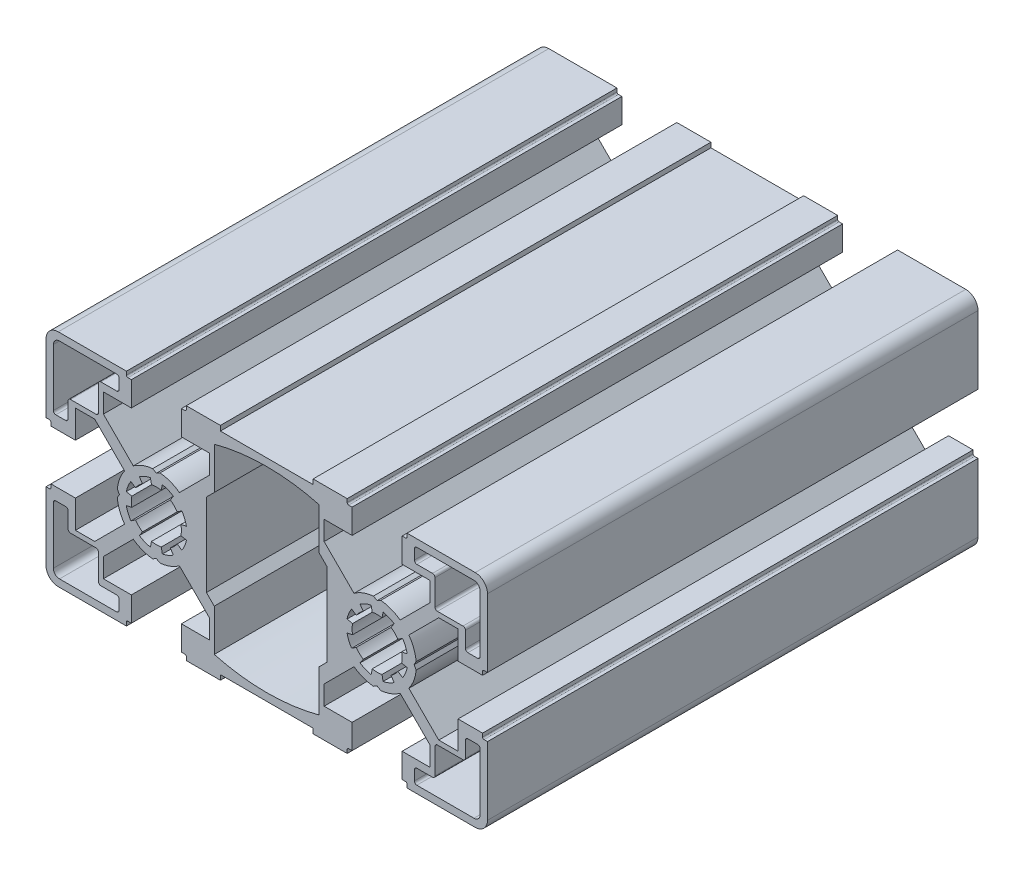
from build123d import *

# Parameters (mm, degrees)
EXTRUDE_1_DEPTH = 100


with BuildPart() as part:
    # 草图1 → 凸台-拉伸1 (new body)
    with BuildSketch(Plane.XY):
        with BuildLine():
            Line((-29.082808051, 22.045792426), (-42.982808051, 22.045792426))
            ThreePointArc((-42.982808051, 22.045792426), (-44.750575003, 21.313559379), (-45.482808051, 19.545792426))
            Line((-45.482808051, 19.545792426), (-45.482808051, 5.645792426))
            Line((-45.482808051, 5.645792426), (-44.782808051, 5.645792426))
            ThreePointArc((-44.782808051, 5.645792426), (-44.570676016, 5.557924461), (-44.482808051, 5.345792426))
            Line((-44.482808051, 5.345792426), (-44.482808051, 4.645792426))
            Line((-44.482808051, 4.645792426), (-42.582808051, 4.645792426))
            Line((-42.582808051, 4.645792426), (-41.382808051, 4.645792426))
            Line((-41.382808051, 4.645792426), (-39.482808051, 4.645792426))
            Line((-39.482808051, 4.645792426), (-39.482808051, 10.345792426))
            Line((-39.482808051, 10.345792426), (-35.550575003, 10.345792426))
            Line((-35.550575003, 10.345792426), (-29.454065687, 4.24928311))
            ThreePointArc((-29.454065687, 4.24928311), (-30.466605076, 2.372943304), (-30.947574212, 0.295792426))
            Line((-30.947574212, 0.295792426), (-30.51456151, -0.454207574))
            Line((-30.51456151, -0.454207574), (-30.947574212, -1.204207574))
            ThreePointArc((-30.947574212, -1.204207574), (-30.466605076, -3.281358452), (-29.454065687, -5.157698257))
            Line((-29.454065687, -5.157698257), (-35.550575003, -11.254207574))
            Line((-35.550575003, -11.254207574), (-39.482808051, -11.254207574))
            Line((-39.482808051, -11.254207574), (-39.482808051, -5.554207574))
            Line((-39.482808051, -5.554207574), (-41.382808051, -5.554207574))
            Line((-41.382808051, -5.554207574), (-42.582808051, -5.554207574))
            Line((-42.582808051, -5.554207574), (-44.482808051, -5.554207574))
            Line((-44.482808051, -5.554207574), (-44.482808051, -6.254207574))
            ThreePointArc((-44.482808051, -6.254207574), (-44.570676016, -6.466339608), (-44.782808051, -6.554207574))
            Line((-44.782808051, -6.554207574), (-45.482808051, -6.554207574))
            Line((-45.482808051, -6.554207574), (-45.482808051, -20.454207574))
            ThreePointArc((-45.482808051, -20.454207574), (-44.750575003, -22.221974527), (-42.982808051, -22.954207574))
            Line((-42.982808051, -22.954207574), (-29.082808051, -22.954207574))
            Line((-29.082808051, -22.954207574), (-29.082808051, -22.254207574))
            ThreePointArc((-29.082808051, -22.254207574), (-28.994940085, -22.042075539), (-28.782808051, -21.954207574))
            Line((-28.782808051, -21.954207574), (-28.082808051, -21.954207574))
            Line((-28.082808051, -21.954207574), (-28.082808051, -20.054207574))
            Line((-28.082808051, -20.054207574), (-28.082808051, -18.854207574))
            Line((-28.082808051, -18.854207574), (-28.082808051, -16.954207574))
            Line((-28.082808051, -16.954207574), (-33.782808051, -16.954207574))
            Line((-33.782808051, -16.954207574), (-33.782808051, -13.021974527))
            Line((-33.782808051, -13.021974527), (-27.686298734, -6.92546521))
            ThreePointArc((-27.686298734, -6.92546521), (-25.809958928, -7.938004599), (-23.732808051, -8.418973735))
            Line((-23.732808051, -8.418973735), (-22.982808051, -7.985961033))
            Line((-22.982808051, -7.985961033), (-22.232808051, -8.418973735))
            ThreePointArc((-22.232808051, -8.418973735), (-20.155657173, -7.938004599), (-18.279317367, -6.92546521))
            Line((-18.279317367, -6.92546521), (-12.182808051, -13.021974527))
            Line((-12.182808051, -13.021974527), (-12.182808051, -16.954207574))
            Line((-12.182808051, -16.954207574), (-17.882808051, -16.954207574))
            Line((-17.882808051, -16.954207574), (-17.882808051, -18.854207574))
            Line((-17.882808051, -18.854207574), (-17.882808051, -20.054207574))
            Line((-17.882808051, -20.054207574), (-17.882808051, -21.954207574))
            Line((-17.882808051, -21.954207574), (-17.182808051, -21.954207574))
            ThreePointArc((-17.182808051, -21.954207574), (-16.970676016, -22.042075539), (-16.882808051, -22.254207574))
            Line((-16.882808051, -22.254207574), (-16.882808051, -22.954207574))
            Line((-16.882808051, -22.954207574), (-9.932808051, -22.954207574))
            Line((-9.932808051, -22.954207574), (-9.932808051, -21.954207574))
            Line((-9.932808051, -21.954207574), (8.967191949, -21.954207574))
            Line((8.967191949, -21.954207574), (8.967191949, -22.954207574))
            Line((8.967191949, -22.954207574), (15.917191949, -22.954207574))
            Line((15.917191949, -22.954207574), (15.917191949, -22.254207574))
            ThreePointArc((15.917191949, -22.254207574), (16.005059915, -22.042075539), (16.217191949, -21.954207574))
            Line((16.217191949, -21.954207574), (16.917191949, -21.954207574))
            Line((16.917191949, -21.954207574), (16.917191949, -20.054207574))
            Line((16.917191949, -20.054207574), (16.917191949, -18.854207574))
            Line((16.917191949, -18.854207574), (16.917191949, -16.954207574))
            Line((16.917191949, -16.954207574), (11.217191949, -16.954207574))
            Line((11.217191949, -16.954207574), (11.217191949, -13.021974527))
            Line((11.217191949, -13.021974527), (17.313701266, -6.92546521))
            ThreePointArc((17.313701266, -6.92546521), (19.190041072, -7.938004599), (21.267191949, -8.418973735))
            Line((21.267191949, -8.418973735), (22.017191949, -7.985961033))
            Line((22.017191949, -7.985961033), (22.767191949, -8.418973735))
            ThreePointArc((22.767191949, -8.418973735), (24.844342827, -7.938004599), (26.720682633, -6.92546521))
            Line((26.720682633, -6.92546521), (32.817191949, -13.021974527))
            Line((32.817191949, -13.021974527), (32.817191949, -16.954207574))
            Line((32.817191949, -16.954207574), (27.117191949, -16.954207574))
            Line((27.117191949, -16.954207574), (27.117191949, -18.854207574))
            Line((27.117191949, -18.854207574), (27.117191949, -20.054207574))
            Line((27.117191949, -20.054207574), (27.117191949, -21.954207574))
            Line((27.117191949, -21.954207574), (27.817191949, -21.954207574))
            ThreePointArc((27.817191949, -21.954207574), (28.029323984, -22.042075539), (28.117191949, -22.254207574))
            Line((28.117191949, -22.254207574), (28.117191949, -22.954207574))
            Line((28.117191949, -22.954207574), (42.017191949, -22.954207574))
            ThreePointArc((42.017191949, -22.954207574), (43.784958902, -22.221974527), (44.517191949, -20.454207574))
            Line((44.517191949, -20.454207574), (44.517191949, -6.554207574))
            Line((44.517191949, -6.554207574), (43.817191949, -6.554207574))
            ThreePointArc((43.817191949, -6.554207574), (43.605059915, -6.466339608), (43.517191949, -6.254207574))
            Line((43.517191949, -6.254207574), (43.517191949, -5.554207574))
            Line((43.517191949, -5.554207574), (41.617191949, -5.554207574))
            Line((41.617191949, -5.554207574), (40.417191949, -5.554207574))
            Line((40.417191949, -5.554207574), (38.517191949, -5.554207574))
            Line((38.517191949, -5.554207574), (38.517191949, -11.254207574))
            Line((38.517191949, -11.254207574), (34.584958902, -11.254207574))
            Line((34.584958902, -11.254207574), (28.488449586, -5.157698257))
            ThreePointArc((28.488449586, -5.157698257), (29.500988975, -3.281358452), (29.981958111, -1.204207574))
            Line((29.981958111, -1.204207574), (29.548945409, -0.454207574))
            Line((29.548945409, -0.454207574), (29.981958111, 0.295792426))
            ThreePointArc((29.981958111, 0.295792426), (29.500988975, 2.372943304), (28.488449586, 4.24928311))
            Line((28.488449586, 4.24928311), (34.584958902, 10.345792426))
            Line((34.584958902, 10.345792426), (38.517191949, 10.345792426))
            Line((38.517191949, 10.345792426), (38.517191949, 4.645792426))
            Line((38.517191949, 4.645792426), (40.417191949, 4.645792426))
            Line((40.417191949, 4.645792426), (41.617191949, 4.645792426))
            Line((41.617191949, 4.645792426), (43.517191949, 4.645792426))
            Line((43.517191949, 4.645792426), (43.517191949, 5.345792426))
            ThreePointArc((43.517191949, 5.345792426), (43.605059915, 5.557924461), (43.817191949, 5.645792426))
            Line((43.817191949, 5.645792426), (44.517191949, 5.645792426))
            Line((44.517191949, 5.645792426), (44.517191949, 19.545792426))
            ThreePointArc((44.517191949, 19.545792426), (43.784958902, 21.313559379), (42.017191949, 22.045792426))
            Line((42.017191949, 22.045792426), (28.117191949, 22.045792426))
            Line((28.117191949, 22.045792426), (28.117191949, 21.345792426))
            ThreePointArc((28.117191949, 21.345792426), (28.029323984, 21.133660392), (27.817191949, 21.045792426))
            Line((27.817191949, 21.045792426), (27.117191949, 21.045792426))
            Line((27.117191949, 21.045792426), (27.117191949, 19.145792426))
            Line((27.117191949, 19.145792426), (27.117191949, 17.945792426))
            Line((27.117191949, 17.945792426), (27.117191949, 16.045792426))
            Line((27.117191949, 16.045792426), (32.817191949, 16.045792426))
            Line((32.817191949, 16.045792426), (32.817191949, 12.113559379))
            Line((32.817191949, 12.113559379), (26.720682633, 6.017050063))
            ThreePointArc((26.720682633, 6.017050063), (24.844342827, 7.029589452), (22.767191949, 7.510558587))
            Line((22.767191949, 7.510558587), (22.017191949, 7.077545886))
            Line((22.017191949, 7.077545886), (21.267191949, 7.510558587))
            ThreePointArc((21.267191949, 7.510558587), (19.190041072, 7.029589452), (17.313701266, 6.017050063))
            Line((17.313701266, 6.017050063), (11.217191949, 12.113559379))
            Line((11.217191949, 12.113559379), (11.217191949, 16.045792426))
            Line((11.217191949, 16.045792426), (16.917191949, 16.045792426))
            Line((16.917191949, 16.045792426), (16.917191949, 17.945792426))
            Line((16.917191949, 17.945792426), (16.917191949, 19.145792426))
            Line((16.917191949, 19.145792426), (16.917191949, 21.045792426))
            Line((16.917191949, 21.045792426), (16.217191949, 21.045792426))
            ThreePointArc((16.217191949, 21.045792426), (16.005059915, 21.133660392), (15.917191949, 21.345792426))
            Line((15.917191949, 21.345792426), (15.917191949, 22.045792426))
            Line((15.917191949, 22.045792426), (8.967191949, 22.045792426))
            Line((8.967191949, 22.045792426), (8.967191949, 21.045792426))
            Line((8.967191949, 21.045792426), (-9.932808051, 21.045792426))
            Line((-9.932808051, 21.045792426), (-9.932808051, 22.045792426))
            Line((-9.932808051, 22.045792426), (-16.882808051, 22.045792426))
            Line((-16.882808051, 22.045792426), (-16.882808051, 21.345792426))
            ThreePointArc((-16.882808051, 21.345792426), (-16.970676016, 21.133660392), (-17.182808051, 21.045792426))
            Line((-17.182808051, 21.045792426), (-17.882808051, 21.045792426))
            Line((-17.882808051, 21.045792426), (-17.882808051, 19.145792426))
            Line((-17.882808051, 19.145792426), (-17.882808051, 17.620792426))
            Line((-17.882808051, 17.620792426), (-17.882808051, 16.045792426))
            Line((-17.882808051, 16.045792426), (-12.182808051, 16.045792426))
            Line((-12.182808051, 16.045792426), (-12.182808051, 12.113559379))
            Line((-12.182808051, 12.113559379), (-18.279317367, 6.017050063))
            ThreePointArc((-18.279317367, 6.017050063), (-20.155657173, 7.029589452), (-22.232808051, 7.510558587))
            Line((-22.232808051, 7.510558587), (-22.982808051, 7.077545886))
            Line((-22.982808051, 7.077545886), (-23.732808051, 7.510558587))
            ThreePointArc((-23.732808051, 7.510558587), (-25.809958928, 7.029589452), (-27.686298734, 6.017050063))
            Line((-27.686298734, 6.017050063), (-33.782808051, 12.113559379))
            Line((-33.782808051, 12.113559379), (-33.782808051, 16.045792426))
            Line((-33.782808051, 16.045792426), (-28.082808051, 16.045792426))
            Line((-28.082808051, 16.045792426), (-28.082808051, 17.945792426))
            Line((-28.082808051, 17.945792426), (-28.082808051, 19.145792426))
            Line((-28.082808051, 19.145792426), (-28.082808051, 21.045792426))
            Line((-28.082808051, 21.045792426), (-28.782808051, 21.045792426))
            ThreePointArc((-28.782808051, 21.045792426), (-28.994940085, 21.133660392), (-29.082808051, 21.345792426))
            Line((-29.082808051, 21.345792426), (-29.082808051, 22.045792426))
        make_face()
        with BuildLine():
            Line((-43.482808051, 7.145792426), (-41.482808051, 7.145792426))
            ThreePointArc((-41.482808051, 7.145792426), (-41.12925466, 7.292239036), (-40.982808051, 7.645792426))
            Line((-40.982808051, 7.645792426), (-40.982808051, 10.845792426))
            ThreePointArc((-40.982808051, 10.845792426), (-40.836361441, 11.199345817), (-40.482808051, 11.345792426))
            Line((-40.482808051, 11.345792426), (-35.282808051, 11.345792426))
            ThreePointArc((-35.282808051, 11.345792426), (-34.92925466, 11.492239036), (-34.782808051, 11.845792426))
            Line((-34.782808051, 11.845792426), (-34.782808051, 17.045792426))
            ThreePointArc((-34.782808051, 17.045792426), (-34.636361441, 17.399345817), (-34.282808051, 17.545792426))
            Line((-34.282808051, 17.545792426), (-31.082808051, 17.545792426))
            ThreePointArc((-31.082808051, 17.545792426), (-30.72925466, 17.692239036), (-30.582808051, 18.045792426))
            Line((-30.582808051, 18.045792426), (-30.582808051, 20.045792426))
            ThreePointArc((-30.582808051, 20.045792426), (-30.72925466, 20.399345817), (-31.082808051, 20.545792426))
            Line((-31.082808051, 20.545792426), (-42.732808051, 20.545792426))
            ThreePointArc((-42.732808051, 20.545792426), (-43.616691527, 20.179675903), (-43.982808051, 19.295792426))
            Line((-43.982808051, 19.295792426), (-43.982808051, 7.645792426))
            ThreePointArc((-43.982808051, 7.645792426), (-43.836361441, 7.292239036), (-43.482808051, 7.145792426))
        make_face(mode=Mode.SUBTRACT)
        with BuildLine():
            Line((-11.182808051, 9.578025473), (-12.782808051, 7.978025473))
            Line((-12.782808051, 7.978025473), (-12.782808051, -8.886440621))
            Line((-12.782808051, -8.886440621), (-11.182808051, -10.486440621))
            Line((-11.182808051, -10.486440621), (-11.182808051, -19.014996693))
            ThreePointArc((-11.182808051, -19.014996693), (-0.482808051, -20.419335391), (10.217191949, -19.014996693))
            Line((10.217191949, -19.014996693), (10.217191949, -10.486440621))
            Line((10.217191949, -10.486440621), (11.817191949, -8.886440621))
            Line((11.817191949, -8.886440621), (11.817191949, 7.978025473))
            Line((11.817191949, 7.978025473), (10.217191949, 9.578025473))
            Line((10.217191949, 9.578025473), (10.217191949, 18.106581546))
            ThreePointArc((10.217191949, 18.106581546), (-0.482808051, 19.510920243), (-11.182808051, 18.106581546))
            Line((-11.182808051, 18.106581546), (-11.182808051, 9.578025473))
        make_face(mode=Mode.SUBTRACT)
        with BuildLine():
            Line((-43.482808051, -8.054207574), (-41.482808051, -8.054207574))
            ThreePointArc((-41.482808051, -8.054207574), (-41.12925466, -8.200654183), (-40.982808051, -8.554207574))
            Line((-40.982808051, -8.554207574), (-40.982808051, -11.754207574))
            ThreePointArc((-40.982808051, -11.754207574), (-40.836361441, -12.107760964), (-40.482808051, -12.254207574))
            Line((-40.482808051, -12.254207574), (-35.282808051, -12.254207574))
            ThreePointArc((-35.282808051, -12.254207574), (-34.92925466, -12.400654183), (-34.782808051, -12.754207574))
            Line((-34.782808051, -12.754207574), (-34.782808051, -17.954207574))
            ThreePointArc((-34.782808051, -17.954207574), (-34.636361441, -18.307760964), (-34.282808051, -18.454207574))
            Line((-34.282808051, -18.454207574), (-31.082808051, -18.454207574))
            ThreePointArc((-31.082808051, -18.454207574), (-30.72925466, -18.600654183), (-30.582808051, -18.954207574))
            Line((-30.582808051, -18.954207574), (-30.582808051, -20.954207574))
            ThreePointArc((-30.582808051, -20.954207574), (-30.72925466, -21.307760964), (-31.082808051, -21.454207574))
            Line((-31.082808051, -21.454207574), (-42.732808051, -21.454207574))
            ThreePointArc((-42.732808051, -21.454207574), (-43.616691527, -21.08809105), (-43.982808051, -20.204207574))
            Line((-43.982808051, -20.204207574), (-43.982808051, -8.554207574))
            ThreePointArc((-43.982808051, -8.554207574), (-43.836361441, -8.200654183), (-43.482808051, -8.054207574))
        make_face(mode=Mode.SUBTRACT)
        with BuildLine():
            Line((-26.455122007, -5.650892651), (-25.816216239, -4.694702596))
            ThreePointArc((-25.816216239, -4.694702596), (-26.589052635, -4.060452158), (-27.223303073, -3.287615762))
            Line((-27.223303073, -3.287615762), (-28.179493127, -3.92652153))
            ThreePointArc((-28.179493127, -3.92652153), (-28.757055129, -2.845979026), (-29.112716053, -1.673522086))
            Line((-29.112716053, -1.673522086), (-27.984812981, -1.449168216))
            ThreePointArc((-27.984812981, -1.449168216), (-28.082808051, -0.454207574), (-27.984812981, 0.540753069))
            Line((-27.984812981, 0.540753069), (-29.112716053, 0.765106939))
            ThreePointArc((-29.112716053, 0.765106939), (-28.757055129, 1.937563879), (-28.179493127, 3.018106383))
            Line((-28.179493127, 3.018106383), (-27.223303073, 2.379200615))
            ThreePointArc((-27.223303073, 2.379200615), (-26.589052635, 3.15203701), (-25.816216239, 3.786287449))
            Line((-25.816216239, 3.786287449), (-26.455122007, 4.742477503))
            ThreePointArc((-26.455122007, 4.742477503), (-25.374579503, 5.320039505), (-24.202122563, 5.675700429))
            Line((-24.202122563, 5.675700429), (-23.977768693, 4.547797356))
            ThreePointArc((-23.977768693, 4.547797356), (-22.982808051, 4.645792426), (-21.987847408, 4.547797356))
            Line((-21.987847408, 4.547797356), (-21.763493538, 5.675700429))
            ThreePointArc((-21.763493538, 5.675700429), (-20.591036598, 5.320039505), (-19.510494094, 4.742477503))
            Line((-19.510494094, 4.742477503), (-20.149399862, 3.786287449))
            ThreePointArc((-20.149399862, 3.786287449), (-19.376563466, 3.15203701), (-18.742313028, 2.379200615))
            Line((-18.742313028, 2.379200615), (-17.786122974, 3.018106383))
            ThreePointArc((-17.786122974, 3.018106383), (-17.208560972, 1.937563879), (-16.852900048, 0.765106939))
            Line((-16.852900048, 0.765106939), (-17.98080312, 0.540753069))
            ThreePointArc((-17.98080312, 0.540753069), (-17.882808051, -0.454207574), (-17.98080312, -1.449168216))
            Line((-17.98080312, -1.449168216), (-16.852900048, -1.673522086))
            ThreePointArc((-16.852900048, -1.673522086), (-17.208560972, -2.845979026), (-17.786122974, -3.92652153))
            Line((-17.786122974, -3.92652153), (-18.742313028, -3.287615762))
            ThreePointArc((-18.742313028, -3.287615762), (-19.376563466, -4.060452158), (-20.149399862, -4.694702596))
            Line((-20.149399862, -4.694702596), (-19.510494094, -5.650892651))
            ThreePointArc((-19.510494094, -5.650892651), (-20.591036598, -6.228454652), (-21.763493538, -6.584115576))
            Line((-21.763493538, -6.584115576), (-21.987847408, -5.456212504))
            ThreePointArc((-21.987847408, -5.456212504), (-22.982808051, -5.554207574), (-23.977768693, -5.456212504))
            Line((-23.977768693, -5.456212504), (-24.202122563, -6.584115576))
            ThreePointArc((-24.202122563, -6.584115576), (-25.374579503, -6.228454652), (-26.455122007, -5.650892651))
        make_face(mode=Mode.SUBTRACT)
        with BuildLine():
            Line((42.517191949, 7.145792426), (40.517191949, 7.145792426))
            ThreePointArc((40.517191949, 7.145792426), (40.163638559, 7.292239036), (40.017191949, 7.645792426))
            Line((40.017191949, 7.645792426), (40.017191949, 10.845792426))
            ThreePointArc((40.017191949, 10.845792426), (39.87074534, 11.199345817), (39.517191949, 11.345792426))
            Line((39.517191949, 11.345792426), (34.317191949, 11.345792426))
            ThreePointArc((34.317191949, 11.345792426), (33.963638559, 11.492239036), (33.817191949, 11.845792426))
            Line((33.817191949, 11.845792426), (33.817191949, 17.045792426))
            ThreePointArc((33.817191949, 17.045792426), (33.67074534, 17.399345817), (33.317191949, 17.545792426))
            Line((33.317191949, 17.545792426), (30.117191949, 17.545792426))
            ThreePointArc((30.117191949, 17.545792426), (29.763638559, 17.692239036), (29.617191949, 18.045792426))
            Line((29.617191949, 18.045792426), (29.617191949, 20.045792426))
            ThreePointArc((29.617191949, 20.045792426), (29.763638559, 20.399345817), (30.117191949, 20.545792426))
            Line((30.117191949, 20.545792426), (41.767191949, 20.545792426))
            ThreePointArc((41.767191949, 20.545792426), (42.651075426, 20.179675903), (43.017191949, 19.295792426))
            Line((43.017191949, 19.295792426), (43.017191949, 7.645792426))
            ThreePointArc((43.017191949, 7.645792426), (42.87074534, 7.292239036), (42.517191949, 7.145792426))
        make_face(mode=Mode.SUBTRACT)
        with BuildLine():
            Line((40.017191949, -8.554207574), (40.017191949, -11.754207574))
            ThreePointArc((40.017191949, -11.754207574), (39.87074534, -12.107760964), (39.517191949, -12.254207574))
            Line((39.517191949, -12.254207574), (34.317191949, -12.254207574))
            ThreePointArc((34.317191949, -12.254207574), (33.963638559, -12.400654183), (33.817191949, -12.754207574))
            Line((33.817191949, -12.754207574), (33.817191949, -17.954207574))
            ThreePointArc((33.817191949, -17.954207574), (33.67074534, -18.307760964), (33.317191949, -18.454207574))
            Line((33.317191949, -18.454207574), (30.117191949, -18.454207574))
            ThreePointArc((30.117191949, -18.454207574), (29.763638559, -18.600654183), (29.617191949, -18.954207574))
            Line((29.617191949, -18.954207574), (29.617191949, -20.954207574))
            ThreePointArc((29.617191949, -20.954207574), (29.763638559, -21.307760964), (30.117191949, -21.454207574))
            Line((30.117191949, -21.454207574), (41.767191949, -21.454207574))
            ThreePointArc((41.767191949, -21.454207574), (42.651075426, -21.08809105), (43.017191949, -20.204207574))
            Line((43.017191949, -20.204207574), (43.017191949, -8.554207574))
            ThreePointArc((43.017191949, -8.554207574), (42.87074534, -8.200654183), (42.517191949, -8.054207574))
            Line((42.517191949, -8.054207574), (40.517191949, -8.054207574))
            ThreePointArc((40.517191949, -8.054207574), (40.163638559, -8.200654183), (40.017191949, -8.554207574))
        make_face(mode=Mode.SUBTRACT)
        with BuildLine():
            Line((18.544877993, -5.650892651), (19.183783761, -4.694702596))
            ThreePointArc((19.183783761, -4.694702596), (18.410947365, -4.060452158), (17.776696927, -3.287615762))
            Line((17.776696927, -3.287615762), (16.820506873, -3.92652153))
            ThreePointArc((16.820506873, -3.92652153), (16.242944871, -2.845979026), (15.887283947, -1.673522086))
            Line((15.887283947, -1.673522086), (17.015187019, -1.449168216))
            ThreePointArc((17.015187019, -1.449168216), (16.917191949, -0.454207574), (17.015187019, 0.540753069))
            Line((17.015187019, 0.540753069), (15.887283947, 0.765106939))
            ThreePointArc((15.887283947, 0.765106939), (16.242944871, 1.937563879), (16.820506873, 3.018106383))
            Line((16.820506873, 3.018106383), (17.776696927, 2.379200615))
            ThreePointArc((17.776696927, 2.379200615), (18.410947365, 3.15203701), (19.183783761, 3.786287449))
            Line((19.183783761, 3.786287449), (18.544877993, 4.742477503))
            ThreePointArc((18.544877993, 4.742477503), (19.625420497, 5.320039505), (20.797877437, 5.675700429))
            Line((20.797877437, 5.675700429), (21.022231307, 4.547797356))
            ThreePointArc((21.022231307, 4.547797356), (22.017191949, 4.645792426), (23.012152592, 4.547797356))
            Line((23.012152592, 4.547797356), (23.236506462, 5.675700429))
            ThreePointArc((23.236506462, 5.675700429), (24.408963402, 5.320039505), (25.489505906, 4.742477503))
            Line((25.489505906, 4.742477503), (24.850600138, 3.786287449))
            ThreePointArc((24.850600138, 3.786287449), (25.623436534, 3.15203701), (26.257686972, 2.379200615))
            Line((26.257686972, 2.379200615), (27.213877026, 3.018106383))
            ThreePointArc((27.213877026, 3.018106383), (27.791439028, 1.937563879), (28.147099952, 0.765106939))
            Line((28.147099952, 0.765106939), (27.01919688, 0.540753069))
            ThreePointArc((27.01919688, 0.540753069), (27.117191949, -0.454207574), (27.01919688, -1.449168216))
            Line((27.01919688, -1.449168216), (28.147099952, -1.673522086))
            ThreePointArc((28.147099952, -1.673522086), (27.791439028, -2.845979026), (27.213877026, -3.92652153))
            Line((27.213877026, -3.92652153), (26.257686972, -3.287615762))
            ThreePointArc((26.257686972, -3.287615762), (25.623436534, -4.060452158), (24.850600138, -4.694702596))
            Line((24.850600138, -4.694702596), (25.489505906, -5.650892651))
            ThreePointArc((25.489505906, -5.650892651), (24.408963402, -6.228454652), (23.236506462, -6.584115576))
            Line((23.236506462, -6.584115576), (23.012152592, -5.456212504))
            ThreePointArc((23.012152592, -5.456212504), (22.017191949, -5.554207574), (21.022231307, -5.456212504))
            Line((21.022231307, -5.456212504), (20.797877437, -6.584115576))
            ThreePointArc((20.797877437, -6.584115576), (19.625420497, -6.228454652), (18.544877993, -5.650892651))
        make_face(mode=Mode.SUBTRACT)
    extrude(amount=EXTRUDE_1_DEPTH)


solid = part.part
